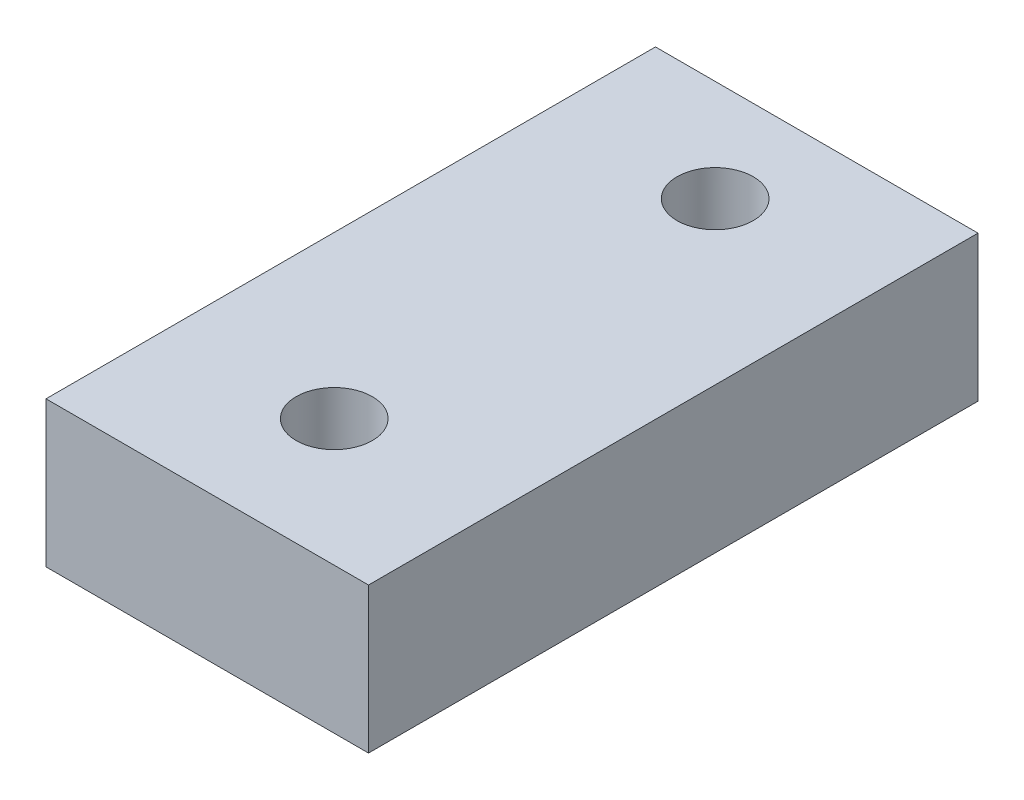
from build123d import *

# Parameters (mm, degrees)
SKETCH1_W           = 12.7
SKETCH1_H           = 24
SKETCH1_R           = 1.5
BOSS_EXTRUDE1_DEPTH = 5.731831


with BuildPart() as part:
    # Sketch1 → Boss-Extrude1 (new body)
    with BuildSketch(Plane(origin=(0, -66.907851618, 0), x_dir=(-1, 0, 0), z_dir=(0, -1, 0))):
        with Locations((-55.934056303, -98.2538327)):
            Rectangle(SKETCH1_W, SKETCH1_H)
        with Locations(Location((-55.934056303, -90.2538327, 0), (0, 0, 90))):
            Circle(SKETCH1_R, mode=Mode.SUBTRACT)
        with Locations(Location((-55.934056303, -105.2538327, 0), (0, 0, 90))):
            Circle(SKETCH1_R, mode=Mode.SUBTRACT)
    extrude(amount=-BOSS_EXTRUDE1_DEPTH)


solid = part.part
